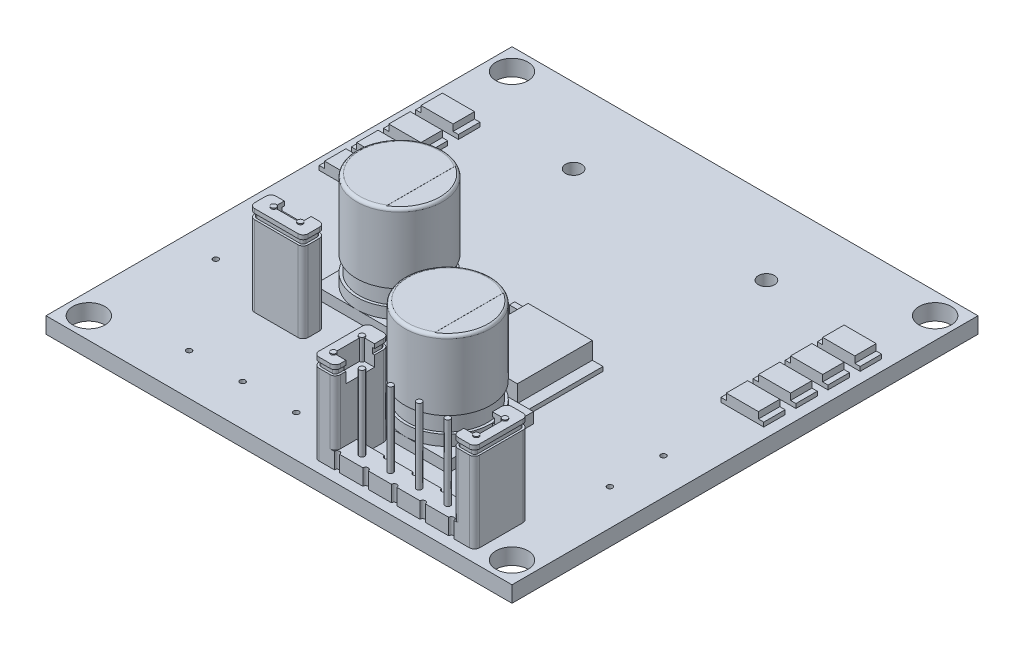
from build123d import *

# Parameters (mm, degrees)
IZIM1_W                                  = 43.5
IZIM1_H                                  = 43.5
IZIM1_R                                  = 1.5
Y_KSEKLIK_EKSTR_ZYON1_DEPTH              = 1.5
IZIM2_R                                  = 0.75
KES_EKSTR_ZYON1_DEPTH                    = 10
IZIM3_W                                  = 8
IZIM3_H                                  = 8
Y_KSEKLIK_EKSTR_ZYON2_DEPTH              = 1
IZIM4_R                                  = 4
Y_KSEKLIK_EKSTR_ZYON3_DEPTH              = 1
IZIM5_R                                  = 3.75
Y_KSEKLIK_EKSTR_ZYON4_DEPTH              = 1.5
IZIM6_R                                  = 4
Y_KSEKLIK_EKSTR_ZYON5_DEPTH              = 6.5
RADYUS1_R                                = 0.3
KES_EKSTR_ZYON2_START                    = -0.01
KES_EKSTR_ZYON2_DEPTH                    = 0.01
IZIM8_R                                  = 0.25
Y_KSEKLIK_EKSTR_ZYON6_DEPTH              = 1.5
KES_EKSTR_ZYON3_START                    = -5
IZIM9_R                                  = 0.25
KES_EKSTR_ZYON3_DEPTH                    = 5
Y_KSEKLIK_EKSTR_ZYON7_DEPTH              = 7
Y_KSEKLIK_EKSTR_ZYON7_DEPTH_BACK         = 3.5
IZIM10_R                                 = 0.25
IZIM11_R                                 = 0.25
Y_KSEKLIK_EKSTR_ZYON8_DEPTH              = 5
Y_KSEKLIK_EKSTR_ZYON10_DEPTH             = 1
Y_KSEKLIK_EKSTR_ZYON11_DEPTH             = 0.5
Y_KSEKLIK_EKSTR_ZYON12_DEPTH             = 0.4
IZIM15_R                                 = 0.25
KES_EKSTR_ZYON4_DEPTH                    = 5
IZIM16_R                                 = 0.25
KES_EKSTR_ZYON5_DEPTH                    = 7
IZIM18_W                                 = 3
IZIM18_H                                 = 2
Y_KSEKLIK_EKSTR_ZYON13_DEPTH             = 1
IZIM19_W                                 = 0.5
IZIM19_H                                 = 2
Y_KSEKLIK_EKSTR_ZYON14_DEPTH             = 0.4
IZIM20_W                                 = 6
IZIM20_H                                 = 7
Y_KSEKLIK_EKSTR_ZYON15_DEPTH             = 2
IZIM21_W                                 = 1
IZIM21_H                                 = 7
Y_KSEKLIK_EKSTR_ZYON16_DEPTH             = 0.4
IZIM22_W                                 = 1.25
IZIM22_H                                 = 1
IZIM22_H_2                               = 0.5
Y_KSEKLIK_EKSTR_ZYON17_DEPTH             = 1.5
IZIM23_R                                 = 0.25
Y_KSEKLIK_EKSTR_ZYON18_DEPTH             = 7.5
Y_KSEKLIK_EKSTR_ZYON19_REACH             = 34.344
IZIM24_R                                 = 0.25
Y_KSEKLIK_EKSTR_ZYON19_DIRECTION_2_REACH = 34.344
Y_KSEKLIK_EKSTR_ZYON20_DEPTH             = 0.5
Y_KSEKLIK_EKSTR_ZYON21_DEPTH             = 0.4


with BuildPart() as part:
    # Çizim1 → Yükseklik-Ekstrüzyon1 (new body)
    with BuildSketch(Plane(origin=(0, 0, 0), x_dir=(1, 0, 0), z_dir=(0, 1, 0))):
        Rectangle(IZIM1_W, IZIM1_H)
        with Locations(Location((-19.75, 19.75, 0), (0, 0, 270))):
            Circle(IZIM1_R, mode=Mode.SUBTRACT)
        with Locations(Location((19.75, 19.75, 0), (0, 0, 90))):
            Circle(IZIM1_R, mode=Mode.SUBTRACT)
        with Locations(Location((19.75, -19.75, 0), (0, 0, 270))):
            Circle(IZIM1_R, mode=Mode.SUBTRACT)
        with Locations(Location((-19.75, -19.75, 0), (0, 0, 90))):
            Circle(IZIM1_R, mode=Mode.SUBTRACT)
    extrude(amount=Y_KSEKLIK_EKSTR_ZYON1_DEPTH)

    # Çizim2 → Kes-Ekstrüzyon1 (cut)
    with BuildSketch(Plane(origin=(0, 1.5, 0), x_dir=(1, 0, 0), z_dir=(0, 1, 0))):
        with Locations(Location((-9, 14.75, 0), (0, 0, 270))):
            Circle(IZIM2_R)
        with Locations(Location((9, 14.75, 0), (0, 0, 270))):
            Circle(IZIM2_R)
    extrude(amount=-KES_EKSTR_ZYON1_DEPTH, mode=Mode.SUBTRACT)

    # Çizim3 → Yükseklik-Ekstrüzyon2 (add)
    with BuildSketch(Plane(origin=(0, 1.5, 0), x_dir=(1, 0, 0), z_dir=(0, 1, 0))):
        with Locations((-6.75, -3.75)):
            Rectangle(IZIM3_W, IZIM3_H)
        with Locations((5.75, -11.75)):
            Rectangle(IZIM3_W, IZIM3_H)
    extrude(amount=Y_KSEKLIK_EKSTR_ZYON2_DEPTH)

    # Çizim4 → Yükseklik-Ekstrüzyon3 (add)
    with BuildSketch(Plane(origin=(0, 2.5, 0), x_dir=(1, 0, 0), z_dir=(0, 1, 0))):
        with Locations(Location((-6.75, -3.75, 0), (0, 0, 270))):
            Circle(IZIM4_R)
        with Locations(Location((5.75, -11.75, 0), (0, 0, 270))):
            Circle(IZIM4_R)
    extrude(amount=Y_KSEKLIK_EKSTR_ZYON3_DEPTH)

    # Çizim5 → Yükseklik-Ekstrüzyon4 (add)
    with BuildSketch(Plane(origin=(0, 3.5, 0), x_dir=(1, 0, 0), z_dir=(0, 1, 0))):
        with Locations(Location((-6.75, -3.75, 0), (0, 0, 270))):
            Circle(IZIM5_R)
        with Locations(Location((5.75, -11.75, 0), (0, 0, 270))):
            Circle(IZIM5_R)
    extrude(amount=Y_KSEKLIK_EKSTR_ZYON4_DEPTH)

    # Çizim6 → Yükseklik-Ekstrüzyon5 (add)
    with BuildSketch(Plane(origin=(0, 5, 0), x_dir=(1, 0, 0), z_dir=(0, 1, 0))):
        with Locations(Location((-6.75, -3.75, 0), (0, 0, 270))):
            Circle(IZIM6_R)
        with Locations(Location((5.75, -11.75, 0), (0, 0, 270))):
            Circle(IZIM6_R)
    extrude(amount=Y_KSEKLIK_EKSTR_ZYON5_DEPTH)

    # Radyus1
    radyus1_edges = [part.edges().sort_by_distance(p)[0] for p in [
        (5.75, 11.5, 7.75),
        (-6.75, 11.5, -0.25),
    ]]
    fillet(radyus1_edges, radius=RADYUS1_R)

    # Çizim7 → Kes-Ekstrüzyon2 (cut)
    with BuildSketch(Plane(origin=(0, 11.5, 0), x_dir=(1, 0, 0), z_dir=(0, 1, 0)).offset(KES_EKSTR_ZYON2_START)):
        with BuildLine():
            Line((-4.74980323, -0.286011998), (-4.74980323, -7.213988002))
            ThreePointArc((-4.74980323, -7.213988002), (-2.75, -3.75), (-4.74980323, -0.286011998))
        make_face()
        with BuildLine():
            Line((7.75, -8.285898385), (7.75, -15.214101615))
            ThreePointArc((7.75, -15.214101615), (9.75, -11.75), (7.75, -8.285898385))
        make_face()
    extrude(amount=KES_EKSTR_ZYON2_DEPTH, mode=Mode.SUBTRACT)

    # Çizim8 → Yükseklik-Ekstrüzyon6 (add)
    with BuildSketch(Plane(origin=(0, 1.5, 0), x_dir=(1, 0, 0), z_dir=(0, 1, 0))):
        with BuildLine():
            Line((4.25, -18.75), (6.833333333, -18.75))
            ThreePointArc((6.833333333, -18.75), (7.083333333, -19), (7.333333333, -18.75))
            Line((7.333333333, -18.75), (9.5, -18.75))
            ThreePointArc((9.5, -18.75), (9.75, -19), (10, -18.75))
            Line((10, -18.75), (12.166666667, -18.75))
            ThreePointArc((12.166666667, -18.75), (12.416666667, -19), (12.666666667, -18.75))
            Line((12.666666667, -18.75), (15.25, -18.75))
            Line((15.25, -18.75), (15.25, -16.226499645))
            ThreePointArc((15.25, -16.226499645), (15.389563515, -15.889563515), (15.726499645, -15.75))
            Line((15.726499645, -15.75), (16.773500355, -15.75))
            ThreePointArc((16.773500355, -15.75), (17.110436485, -15.889563515), (17.25, -16.226499645))
            Line((17.25, -16.226499645), (17.25, -20.273500355))
            ThreePointArc((17.25, -20.273500355), (17.110436485, -20.610436485), (16.773500355, -20.75))
            Line((16.773500355, -20.75), (15.333333333, -20.75))
            ThreePointArc((15.333333333, -20.75), (15.083333333, -20.5), (14.833333333, -20.75))
            Line((14.833333333, -20.75), (12.666666667, -20.75))
            ThreePointArc((12.666666667, -20.75), (12.416666667, -20.5), (12.166666667, -20.75))
            Line((12.166666667, -20.75), (10, -20.75))
            ThreePointArc((10, -20.75), (9.75, -20.5), (9.5, -20.75))
            Line((9.5, -20.75), (7.333333333, -20.75))
            ThreePointArc((7.333333333, -20.75), (7.083333333, -20.5), (6.833333333, -20.75))
            Line((6.833333333, -20.75), (4.666666667, -20.75))
            ThreePointArc((4.666666667, -20.75), (4.416666667, -20.5), (4.166666667, -20.75))
            Line((4.166666667, -20.75), (2.726499645, -20.75))
            ThreePointArc((2.726499645, -20.75), (2.389563515, -20.610436485), (2.25, -20.273500355))
            Line((2.25, -20.273500355), (2.25, -16.226499645))
            ThreePointArc((2.25, -16.226499645), (2.389563515, -15.889563515), (2.726499645, -15.75))
            Line((2.726499645, -15.75), (3.773500355, -15.75))
            ThreePointArc((3.773500355, -15.75), (4.110436485, -15.889563515), (4.25, -16.226499645))
            Line((4.25, -16.226499645), (4.25, -18.75))
        make_face()
        with Locations(Location((11.085, -19.75, 0), (0, 0, 270))):
            Circle(IZIM8_R, mode=Mode.SUBTRACT)
        with Locations(Location((13.755, -19.75, 0), (0, 0, 270))):
            Circle(IZIM8_R, mode=Mode.SUBTRACT)
        with Locations(Location((16.425, -19.75, 0), (0, 0, 270))):
            Circle(IZIM8_R, mode=Mode.SUBTRACT)
        with Locations(Location((16.425, -17.08, 0), (0, 0, 270))):
            Circle(IZIM8_R, mode=Mode.SUBTRACT)
        with Locations(Location((3.075, -17.08, 0), (0, 0, 90))):
            Circle(IZIM8_R, mode=Mode.SUBTRACT)
        with Locations(Location((3.075, -19.75, 0), (0, 0, 90))):
            Circle(IZIM8_R, mode=Mode.SUBTRACT)
        with Locations(Location((5.745, -19.75, 0), (0, 0, 90))):
            Circle(IZIM8_R, mode=Mode.SUBTRACT)
        with Locations(Location((8.415, -19.75, 0), (0, 0, 90))):
            Circle(IZIM8_R, mode=Mode.SUBTRACT)
    extrude(amount=Y_KSEKLIK_EKSTR_ZYON6_DEPTH)

    # Çizim9 → Kes-Ekstrüzyon3 (cut)
    with BuildSketch(Plane(origin=(0, 3, 0), x_dir=(1, 0, 0), z_dir=(0, 1, 0)).offset(KES_EKSTR_ZYON3_START)):
        with Locations(Location((3.075, -17.08, 0), (0, 0, 90))):
            Circle(IZIM9_R)
        with Locations(Location((3.075, -19.75, 0), (0, 0, 90))):
            Circle(IZIM9_R)
        with Locations(Location((5.745, -19.75, 0), (0, 0, 90))):
            Circle(IZIM9_R)
        with Locations(Location((8.415, -19.75, 0), (0, 0, 90))):
            Circle(IZIM9_R)
        with Locations(Location((11.085, -19.75, 0), (0, 0, 270))):
            Circle(IZIM9_R)
        with Locations(Location((13.755, -19.75, 0), (0, 0, 270))):
            Circle(IZIM9_R)
        with Locations(Location((16.425, -19.75, 0), (0, 0, 270))):
            Circle(IZIM9_R)
        with Locations(Location((16.425, -17.08, 0), (0, 0, 270))):
            Circle(IZIM9_R)
    extrude(amount=KES_EKSTR_ZYON3_DEPTH, mode=Mode.SUBTRACT)

    # Çizim10 → Yükseklik-Ekstrüzyon7 (add, two sides: drawn at the far end of the back side and taken through both)
    with BuildSketch(Plane(origin=(0, 3, 0), x_dir=(1, 0, 0), z_dir=(0, 1, 0)).offset(-Y_KSEKLIK_EKSTR_ZYON7_DEPTH_BACK)):
        with Locations(Location((3.075, -17.08, 0), (0, 0, 270))):
            Circle(IZIM10_R)
        with Locations(Location((3.075, -19.75, 0), (0, 0, 270))):
            Circle(IZIM10_R)
        with Locations(Location((5.745, -19.75, 0), (0, 0, 270))):
            Circle(IZIM10_R)
        with Locations(Location((8.415, -19.75, 0), (0, 0, 270))):
            Circle(IZIM10_R)
        with Locations(Location((11.085, -19.75, 0), (0, 0, 270))):
            Circle(IZIM10_R)
        with Locations(Location((13.755, -19.75, 0), (0, 0, 270))):
            Circle(IZIM10_R)
        with Locations(Location((16.425, -19.75, 0), (0, 0, 270))):
            Circle(IZIM10_R)
        with Locations(Location((16.425, -17.08, 0), (0, 0, 270))):
            Circle(IZIM10_R)
    extrude(amount=Y_KSEKLIK_EKSTR_ZYON7_DEPTH + Y_KSEKLIK_EKSTR_ZYON7_DEPTH_BACK)

    # Çizim11 → Yükseklik-Ekstrüzyon8 (add)
    # profile 1 of 2: a face of its own
    with BuildSketch(Plane(origin=(0, 3, 0), x_dir=(1, 0, 0), z_dir=(0, 1, 0))):
        with BuildLine():
            Line((16.773500355, -20.75), (15.726499645, -20.75))
            ThreePointArc((15.726499645, -20.75), (15.389563515, -20.610436485), (15.25, -20.273500355))
            Line((15.25, -20.273500355), (15.25, -16.226499645))
            ThreePointArc((15.25, -16.226499645), (15.389563515, -15.889563515), (15.726499645, -15.75))
            Line((15.726499645, -15.75), (16.773500355, -15.75))
            ThreePointArc((16.773500355, -15.75), (17.110436485, -15.889563515), (17.25, -16.226499645))
            Line((17.25, -16.226499645), (17.25, -20.273500355))
            ThreePointArc((17.25, -20.273500355), (17.110436485, -20.610436485), (16.773500355, -20.75))
        make_face()
        with Locations(Location((16.425, -19.75, 0), (0, 0, 270))):
            Circle(IZIM11_R, mode=Mode.SUBTRACT)
        with Locations(Location((16.425, -17.08, 0), (0, 0, 270))):
            Circle(IZIM11_R, mode=Mode.SUBTRACT)
    # profile 2 of 2: a face of its own
    with BuildSketch(Plane(origin=(0, 3, 0), x_dir=(1, 0, 0), z_dir=(0, 1, 0))):
        with BuildLine():
            Line((2.726499645, -15.75), (3.773500355, -15.75))
            ThreePointArc((3.773500355, -15.75), (4.110436485, -15.889563515), (4.25, -16.226499645))
            Line((4.25, -16.226499645), (4.25, -20.273500355))
            ThreePointArc((4.25, -20.273500355), (4.110436485, -20.610436485), (3.773500355, -20.75))
            Line((3.773500355, -20.75), (2.726499645, -20.75))
            ThreePointArc((2.726499645, -20.75), (2.389563515, -20.610436485), (2.25, -20.273500355))
            Line((2.25, -20.273500355), (2.25, -16.226499645))
            ThreePointArc((2.25, -16.226499645), (2.389563515, -15.889563515), (2.726499645, -15.75))
        make_face()
        with Locations(Location((3.075, -17.08, 0), (0, 0, 270))):
            Circle(IZIM11_R, mode=Mode.SUBTRACT)
        with Locations(Location((3.075, -19.75, 0), (0, 0, 270))):
            Circle(IZIM11_R, mode=Mode.SUBTRACT)
    extrude(amount=Y_KSEKLIK_EKSTR_ZYON8_DEPTH)

    # Çizim12 → Yükseklik-Ekstrüzyon10 (add)
    with BuildSketch(Plane(origin=(0, 8, 0), x_dir=(1, 0, 0), z_dir=(0, 1, 0))):
        with BuildLine():
            Line((3.325, -17.08), (4.25, -17.08))
            Line((4.25, -17.08), (4.25, -16.226499645))
            ThreePointArc((4.25, -16.226499645), (4.110436485, -15.889563515), (3.773500355, -15.75))
            Line((3.773500355, -15.75), (2.726499645, -15.75))
            ThreePointArc((2.726499645, -15.75), (2.389563515, -15.889563515), (2.25, -16.226499645))
            Line((2.25, -16.226499645), (2.25, -20.273500355))
            ThreePointArc((2.25, -20.273500355), (2.389563515, -20.610436485), (2.726499645, -20.75))
            Line((2.726499645, -20.75), (3.773500355, -20.75))
            ThreePointArc((3.773500355, -20.75), (4.110436485, -20.610436485), (4.25, -20.273500355))
            Line((4.25, -20.273500355), (4.25, -19.75))
            Line((4.25, -19.75), (3.325, -19.75))
            ThreePointArc((3.325, -19.75), (2.898223305, -19.926776695), (3.075, -19.5))
            Line((3.075, -19.5), (3.075, -17.33))
            ThreePointArc((3.075, -17.33), (2.898223305, -16.903223305), (3.325, -17.08))
        make_face()
        with BuildLine():
            Line((16.175, -17.08), (15.25, -17.08))
            Line((15.25, -17.08), (15.25, -16.226499645))
            ThreePointArc((15.25, -16.226499645), (15.389563515, -15.889563515), (15.726499645, -15.75))
            Line((15.726499645, -15.75), (16.773500355, -15.75))
            ThreePointArc((16.773500355, -15.75), (17.110436485, -15.889563515), (17.25, -16.226499645))
            Line((17.25, -16.226499645), (17.25, -20.273500355))
            ThreePointArc((17.25, -20.273500355), (17.110436485, -20.610436485), (16.773500355, -20.75))
            Line((16.773500355, -20.75), (15.726499645, -20.75))
            ThreePointArc((15.726499645, -20.75), (15.389563515, -20.610436485), (15.25, -20.273500355))
            Line((15.25, -20.273500355), (15.25, -19.75))
            Line((15.25, -19.75), (16.175, -19.75))
            ThreePointArc((16.175, -19.75), (16.601776695, -19.926776695), (16.425, -19.5))
            Line((16.425, -19.5), (16.425, -17.33))
            ThreePointArc((16.425, -17.33), (16.601776695, -16.903223305), (16.175, -17.08))
        make_face()
    extrude(amount=Y_KSEKLIK_EKSTR_ZYON10_DEPTH)

    # Çizim13 → Yükseklik-Ekstrüzyon11 (add)
    with BuildSketch(Plane(origin=(0, 9, 0), x_dir=(1, 0, 0), z_dir=(0, 1, 0))):
        with BuildLine():
            Line((3.075, -17.33), (3.075, -19.5))
            ThreePointArc((3.075, -19.5), (2.898223305, -19.926776695), (3.325, -19.75))
            Line((3.325, -19.75), (4.061841211, -19.75))
            Line((4.061841211, -19.75), (4.061841211, -20.266506285))
            ThreePointArc((4.061841211, -20.266506285), (3.98085634, -20.462021059), (3.785341566, -20.54300593))
            Line((3.785341566, -20.54300593), (2.714658434, -20.54300593))
            ThreePointArc((2.714658434, -20.54300593), (2.51914366, -20.462021059), (2.438158789, -20.266506285))
            Line((2.438158789, -20.266506285), (2.438158789, -16.233493715))
            ThreePointArc((2.438158789, -16.233493715), (2.51914366, -16.037978941), (2.714658434, -15.95699407))
            Line((2.714658434, -15.95699407), (3.785341566, -15.95699407))
            ThreePointArc((3.785341566, -15.95699407), (3.98085634, -16.037978941), (4.061841211, -16.233493715))
            Line((4.061841211, -16.233493715), (4.061841211, -17.08))
            Line((4.061841211, -17.08), (3.325, -17.08))
            ThreePointArc((3.325, -17.08), (2.898223305, -16.903223305), (3.075, -17.33))
        make_face()
        with BuildLine():
            Line((16.785341566, -15.95699407), (15.714658434, -15.95699407))
            ThreePointArc((15.714658434, -15.95699407), (15.51914366, -16.037978941), (15.438158789, -16.233493715))
            Line((15.438158789, -16.233493715), (15.438158789, -17.08))
            Line((15.438158789, -17.08), (16.175, -17.08))
            ThreePointArc((16.175, -17.08), (16.601776695, -16.903223305), (16.425, -17.33))
            Line((16.425, -17.33), (16.425, -19.5))
            ThreePointArc((16.425, -19.5), (16.601776695, -19.926776695), (16.175, -19.75))
            Line((16.175, -19.75), (15.438158789, -19.75))
            Line((15.438158789, -19.75), (15.438158789, -20.266506285))
            ThreePointArc((15.438158789, -20.266506285), (15.51914366, -20.462021059), (15.714658434, -20.54300593))
            Line((15.714658434, -20.54300593), (16.785341566, -20.54300593))
            ThreePointArc((16.785341566, -20.54300593), (16.98085634, -20.462021059), (17.061841211, -20.266506285))
            Line((17.061841211, -20.266506285), (17.061841211, -16.233493715))
            ThreePointArc((17.061841211, -16.233493715), (16.98085634, -16.037978941), (16.785341566, -15.95699407))
        make_face()
    extrude(amount=Y_KSEKLIK_EKSTR_ZYON11_DEPTH)

    # Çizim14 → Yükseklik-Ekstrüzyon12 (add)
    with BuildSketch(Plane(origin=(0, 9.5, 0), x_dir=(1, 0, 0), z_dir=(0, 1, 0))):
        with BuildLine():
            Line((4.25, -17.08), (3.325, -17.08))
            ThreePointArc((3.325, -17.08), (2.898223305, -16.903223305), (3.075, -17.33))
            Line((3.075, -17.33), (3.075, -19.5))
            ThreePointArc((3.075, -19.5), (2.898223305, -19.926776695), (3.325, -19.75))
            Line((3.325, -19.75), (4.25, -19.75))
            Line((4.25, -19.75), (4.25, -20.273500355))
            ThreePointArc((4.25, -20.273500355), (4.110436485, -20.610436485), (3.773500355, -20.75))
            Line((3.773500355, -20.75), (2.726499645, -20.75))
            ThreePointArc((2.726499645, -20.75), (2.389563515, -20.610436485), (2.25, -20.273500355))
            Line((2.25, -20.273500355), (2.25, -16.226499645))
            ThreePointArc((2.25, -16.226499645), (2.389563515, -15.889563515), (2.726499645, -15.75))
            Line((2.726499645, -15.75), (3.773500355, -15.75))
            ThreePointArc((3.773500355, -15.75), (4.110436485, -15.889563515), (4.25, -16.226499645))
            Line((4.25, -16.226499645), (4.25, -17.08))
        make_face()
        with BuildLine():
            Line((15.25, -17.08), (16.175, -17.08))
            ThreePointArc((16.175, -17.08), (16.601776695, -16.903223305), (16.425, -17.33))
            Line((16.425, -17.33), (16.425, -19.5))
            ThreePointArc((16.425, -19.5), (16.601776695, -19.926776695), (16.175, -19.75))
            Line((16.175, -19.75), (15.25, -19.75))
            Line((15.25, -19.75), (15.25, -20.273500355))
            ThreePointArc((15.25, -20.273500355), (15.389563515, -20.610436485), (15.726499645, -20.75))
            Line((15.726499645, -20.75), (16.773500355, -20.75))
            ThreePointArc((16.773500355, -20.75), (17.110436485, -20.610436485), (17.25, -20.273500355))
            Line((17.25, -20.273500355), (17.25, -16.226499645))
            ThreePointArc((17.25, -16.226499645), (17.110436485, -15.889563515), (16.773500355, -15.75))
            Line((16.773500355, -15.75), (15.726499645, -15.75))
            ThreePointArc((15.726499645, -15.75), (15.389563515, -15.889563515), (15.25, -16.226499645))
            Line((15.25, -16.226499645), (15.25, -17.08))
        make_face()
    extrude(amount=Y_KSEKLIK_EKSTR_ZYON12_DEPTH)

    # Çizim15 → Kes-Ekstrüzyon4 (cut)
    with BuildSketch(Plane(origin=(0, 1.5, 0), x_dir=(1, 0, 0), z_dir=(0, 1, 0))):
        with Locations(Location((-12.25, -17.89, 0), (0, 0, 270))):
            Circle(IZIM15_R)
        with Locations(Location((-7.25, -17.89, 0), (0, 0, 270))):
            Circle(IZIM15_R)
        with Locations(Location((-2.25, -17.89, 0), (0, 0, 270))):
            Circle(IZIM15_R)
    extrude(amount=-KES_EKSTR_ZYON4_DEPTH, mode=Mode.SUBTRACT)

    # Çizim16 → Kes-Ekstrüzyon5 (cut)
    with BuildSketch(Plane(origin=(0, 1.5, 0), x_dir=(1, 0, 0), z_dir=(0, 1, 0))):
        with Locations(Location((18.39, -4.25, 0), (0, 0, 270))):
            Circle(IZIM16_R)
        with Locations(Location((18.39, -9.25, 0), (0, 0, 270))):
            Circle(IZIM16_R)
        with Locations(Location((-18.39, -9.25, 0), (0, 0, 270))):
            Circle(IZIM16_R)
        with Locations(Location((-18.39, -4.25, 0), (0, 0, 270))):
            Circle(IZIM16_R)
    extrude(amount=-KES_EKSTR_ZYON5_DEPTH, mode=Mode.SUBTRACT)

    # Çizim18 → Yükseklik-Ekstrüzyon13 (add)
    with BuildSketch(Plane(origin=(0, 1.5, 0), x_dir=(1, 0, 0), z_dir=(0, 1, 0))):
        with Locations((18.75, 12.75)):
            Rectangle(IZIM18_W, IZIM18_H)
        with Locations((18.75, 9.75)):
            Rectangle(IZIM18_W, IZIM18_H)
        with Locations((18.75, 6.75)):
            Rectangle(IZIM18_W, IZIM18_H)
        with Locations((18.75, 3.75)):
            Rectangle(IZIM18_W, IZIM18_H)
        with Locations((-18.75, 3.75)):
            Rectangle(IZIM18_W, IZIM18_H)
        with Locations((-18.75, 6.75)):
            Rectangle(IZIM18_W, IZIM18_H)
        with Locations((-18.75, 9.75)):
            Rectangle(IZIM18_W, IZIM18_H)
        with Locations((-18.75, 12.75)):
            Rectangle(IZIM18_W, IZIM18_H)
    extrude(amount=Y_KSEKLIK_EKSTR_ZYON13_DEPTH)

    # Çizim19 → Yükseklik-Ekstrüzyon14 (add)
    with BuildSketch(Plane(origin=(0, 1.5, 0), x_dir=(1, 0, 0), z_dir=(0, 1, 0))):
        with Locations((17, 12.75)):
            Rectangle(IZIM19_W, IZIM19_H)
        with Locations((20.5, 12.75)):
            Rectangle(IZIM19_W, IZIM19_H)
        with Locations((20.5, 9.75)):
            Rectangle(IZIM19_W, IZIM19_H)
        with Locations((17, 9.75)):
            Rectangle(IZIM19_W, IZIM19_H)
        with Locations((20.5, 6.75)):
            Rectangle(IZIM19_W, IZIM19_H)
        with Locations((17, 6.75)):
            Rectangle(IZIM19_W, IZIM19_H)
        with Locations((20.5, 3.75)):
            Rectangle(IZIM19_W, IZIM19_H)
        with Locations((17, 3.75)):
            Rectangle(IZIM19_W, IZIM19_H)
        with Locations((-20.5, 3.75)):
            Rectangle(IZIM19_W, IZIM19_H)
        with Locations((-17, 3.75)):
            Rectangle(IZIM19_W, IZIM19_H)
        with Locations((-20.5, 6.75)):
            Rectangle(IZIM19_W, IZIM19_H)
        with Locations((-17, 6.75)):
            Rectangle(IZIM19_W, IZIM19_H)
        with Locations((-17, 9.75)):
            Rectangle(IZIM19_W, IZIM19_H)
        with Locations((-20.5, 9.75)):
            Rectangle(IZIM19_W, IZIM19_H)
        with Locations((-20.5, 12.75)):
            Rectangle(IZIM19_W, IZIM19_H)
        with Locations((-17, 12.75)):
            Rectangle(IZIM19_W, IZIM19_H)
    extrude(amount=Y_KSEKLIK_EKSTR_ZYON14_DEPTH)

    # Çizim20 → Yükseklik-Ekstrüzyon15 (add)
    with BuildSketch(Plane(origin=(0, 1.5, 0), x_dir=(1, 0, 0), z_dir=(0, 1, 0))):
        with Locations((4.75, -3.75)):
            Rectangle(IZIM20_W, IZIM20_H)
    extrude(amount=Y_KSEKLIK_EKSTR_ZYON15_DEPTH)

    # Çizim21 → Yükseklik-Ekstrüzyon16 (add)
    with BuildSketch(Plane(origin=(0, 1.5, 0), x_dir=(1, 0, 0), z_dir=(0, 1, 0))):
        with Locations((8.25, -3.75)):
            Rectangle(IZIM21_W, IZIM21_H)
    extrude(amount=Y_KSEKLIK_EKSTR_ZYON16_DEPTH)

    # Çizim22 → Yükseklik-Ekstrüzyon17 (add)
    with BuildSketch(Plane(origin=(0, 1.5, 0), x_dir=(1, 0, 0), z_dir=(0, 1, 0))):
        with Locations((1.125, -3.75)):
            Rectangle(IZIM22_W, IZIM22_H)
        with Locations((1.125, -7)):
            Rectangle(IZIM22_W, IZIM22_H_2)
        with Locations((1.125, -0.5)):
            Rectangle(IZIM22_W, IZIM22_H_2)
    extrude(amount=Y_KSEKLIK_EKSTR_ZYON17_DEPTH)

    # Çizim23 → Yükseklik-Ekstrüzyon18 (add)
    with BuildSketch(Plane(origin=(0, 1.5, 0), x_dir=(1, 0, 0), z_dir=(0, 1, 0))):
        with BuildLine():
            Line((-12.273500355, -11.75), (-8.226499645, -11.75))
            ThreePointArc((-8.226499645, -11.75), (-7.889563515, -11.610436485), (-7.75, -11.273500355))
            Line((-7.75, -11.273500355), (-7.75, -10.226499645))
            ThreePointArc((-7.75, -10.226499645), (-7.889563515, -9.889563515), (-8.226499645, -9.75))
            Line((-8.226499645, -9.75), (-12.273500355, -9.75))
            ThreePointArc((-12.273500355, -9.75), (-12.610436485, -9.889563515), (-12.75, -10.226499645))
            Line((-12.75, -10.226499645), (-12.75, -11.273500355))
            ThreePointArc((-12.75, -11.273500355), (-12.610436485, -11.610436485), (-12.273500355, -11.75))
        make_face()
        with Locations(Location((-11.5, -10.75, 0), (0, 0, 270))):
            Circle(IZIM23_R, mode=Mode.SUBTRACT)
        with Locations(Location((-9, -10.75, 0), (0, 0, 270))):
            Circle(IZIM23_R, mode=Mode.SUBTRACT)
    extrude(amount=Y_KSEKLIK_EKSTR_ZYON18_DEPTH)

    # Yükseklik-Ekstrüzyon19: up to this face of the body (flat: up to its plane)
    y_kseklik_ekstr_zyon19_end = Plane(part.part.faces().sort_by_distance((11.085, 10, 19.75))[0])
    # Çizim24 → Yükseklik-Ekstrüzyon19 (add, up to the picked face)
    with BuildSketch(Plane(origin=(0, 1.5, 0), x_dir=(1, 0, 0), z_dir=(0, 1, 0)), mode=Mode.PRIVATE) as y_kseklik_ekstr_zyon19_sk1:
        with Locations(Location((-11.5, -10.75, 0), (0, 0, 270))):
            Circle(IZIM24_R)
    y_kseklik_ekstr_zyon19_tool1 = split(extrude(y_kseklik_ekstr_zyon19_sk1.sketch, amount=Y_KSEKLIK_EKSTR_ZYON19_REACH, mode=Mode.PRIVATE), bisect_by=y_kseklik_ekstr_zyon19_end, keep=Keep.BOTH, mode=Mode.PRIVATE)
    # Çizim24 → Yükseklik-Ekstrüzyon19 (add, up to the picked face)
    with BuildSketch(Plane(origin=(0, 1.5, 0), x_dir=(1, 0, 0), z_dir=(0, 1, 0)), mode=Mode.PRIVATE) as y_kseklik_ekstr_zyon19_sk2:
        with Locations(Location((-9, -10.75, 0), (0, 0, 270))):
            Circle(IZIM24_R)
    y_kseklik_ekstr_zyon19_tool2 = split(extrude(y_kseklik_ekstr_zyon19_sk2.sketch, amount=Y_KSEKLIK_EKSTR_ZYON19_REACH, mode=Mode.PRIVATE), bisect_by=y_kseklik_ekstr_zyon19_end, keep=Keep.BOTH, mode=Mode.PRIVATE)
    add(y_kseklik_ekstr_zyon19_tool1.solids().sort_by(Axis((-11.5, 1.5, 10.75), (0, 1, 0)))[0])
    add(y_kseklik_ekstr_zyon19_tool2.solids().sort_by(Axis((-9, 1.5, 10.75), (0, 1, 0)))[0])

    # Yükseklik-Ekstrüzyon19 direction 2: up to this face of the body (flat: up to its plane)
    y_kseklik_ekstr_zyon19_direction_2_end = Plane(part.part.faces().sort_by_distance((3.075, -0.5, 17.08))[0])
    # Çizim24 → Yükseklik-Ekstrüzyon19 direction 2 (add, up to the picked face)
    with BuildSketch(Plane(origin=(0, 1.5, 0), x_dir=(1, 0, 0), z_dir=(0, 1, 0)), mode=Mode.PRIVATE) as y_kseklik_ekstr_zyon19_direction_2_sk1:
        with Locations(Location((-11.5, -10.75, 0), (0, 0, 270))):
            Circle(IZIM24_R)
    y_kseklik_ekstr_zyon19_direction_2_tool1 = split(extrude(y_kseklik_ekstr_zyon19_direction_2_sk1.sketch, amount=-Y_KSEKLIK_EKSTR_ZYON19_DIRECTION_2_REACH, mode=Mode.PRIVATE), bisect_by=y_kseklik_ekstr_zyon19_direction_2_end, keep=Keep.BOTH, mode=Mode.PRIVATE)
    # Çizim24 → Yükseklik-Ekstrüzyon19 direction 2 (add, up to the picked face)
    with BuildSketch(Plane(origin=(0, 1.5, 0), x_dir=(1, 0, 0), z_dir=(0, 1, 0)), mode=Mode.PRIVATE) as y_kseklik_ekstr_zyon19_direction_2_sk2:
        with Locations(Location((-9, -10.75, 0), (0, 0, 270))):
            Circle(IZIM24_R)
    y_kseklik_ekstr_zyon19_direction_2_tool2 = split(extrude(y_kseklik_ekstr_zyon19_direction_2_sk2.sketch, amount=-Y_KSEKLIK_EKSTR_ZYON19_DIRECTION_2_REACH, mode=Mode.PRIVATE), bisect_by=y_kseklik_ekstr_zyon19_direction_2_end, keep=Keep.BOTH, mode=Mode.PRIVATE)
    add(y_kseklik_ekstr_zyon19_direction_2_tool1.solids().sort_by(Axis((-11.5, 1.5, 10.75), (0, -1, 0)))[0])
    add(y_kseklik_ekstr_zyon19_direction_2_tool2.solids().sort_by(Axis((-9, 1.5, 10.75), (0, -1, 0)))[0])

    # Çizim25 → Yükseklik-Ekstrüzyon20 (add)
    with BuildSketch(Plane(origin=(0, 9, 0), x_dir=(1, 0, 0), z_dir=(0, 1, 0))):
        with BuildLine():
            Line((-12.55, -10.226499645), (-12.55, -11.273500355))
            ThreePointArc((-12.55, -11.273500355), (-12.469015129, -11.469015129), (-12.273500355, -11.55))
            Line((-12.273500355, -11.55), (-8.226499645, -11.55))
            ThreePointArc((-8.226499645, -11.55), (-8.030984871, -11.469015129), (-7.95, -11.273500355))
            Line((-7.95, -11.273500355), (-7.95, -10.226499645))
            ThreePointArc((-7.95, -10.226499645), (-8.030984871, -10.030984871), (-8.226499645, -9.95))
            Line((-8.226499645, -9.95), (-9, -9.95))
            Line((-9, -9.95), (-9, -10.5))
            ThreePointArc((-9, -10.5), (-8.823223305, -10.926776695), (-9.25, -10.75))
            Line((-9.25, -10.75), (-11.25, -10.75))
            ThreePointArc((-11.25, -10.75), (-11.676776695, -10.926776695), (-11.5, -10.5))
            Line((-11.5, -10.5), (-11.5, -9.95))
            Line((-11.5, -9.95), (-12.273500355, -9.95))
            ThreePointArc((-12.273500355, -9.95), (-12.469015129, -10.030984871), (-12.55, -10.226499645))
        make_face()
    extrude(amount=Y_KSEKLIK_EKSTR_ZYON20_DEPTH)

    # Çizim27 → Yükseklik-Ekstrüzyon21 (add)
    with BuildSketch(Plane(origin=(0, 9.5, 0), x_dir=(1, 0, 0), z_dir=(0, 1, 0))):
        with BuildLine():
            Line((-11.5, -9.75), (-11.5, -10.5))
            ThreePointArc((-11.5, -10.5), (-11.676776695, -10.926776695), (-11.25, -10.75))
            Line((-11.25, -10.75), (-9.25, -10.75))
            ThreePointArc((-9.25, -10.75), (-8.823223305, -10.926776695), (-9, -10.5))
            Line((-9, -10.5), (-9, -9.75))
            Line((-9, -9.75), (-8.226499645, -9.75))
            ThreePointArc((-8.226499645, -9.75), (-7.889563515, -9.889563515), (-7.75, -10.226499645))
            Line((-7.75, -10.226499645), (-7.75, -11.273500355))
            ThreePointArc((-7.75, -11.273500355), (-7.889563515, -11.610436485), (-8.226499645, -11.75))
            Line((-8.226499645, -11.75), (-12.273500355, -11.75))
            ThreePointArc((-12.273500355, -11.75), (-12.610436485, -11.610436485), (-12.75, -11.273500355))
            Line((-12.75, -11.273500355), (-12.75, -10.226499645))
            ThreePointArc((-12.75, -10.226499645), (-12.610436485, -9.889563515), (-12.273500355, -9.75))
            Line((-12.273500355, -9.75), (-11.5, -9.75))
        make_face()
    extrude(amount=Y_KSEKLIK_EKSTR_ZYON21_DEPTH)


solid = part.part
